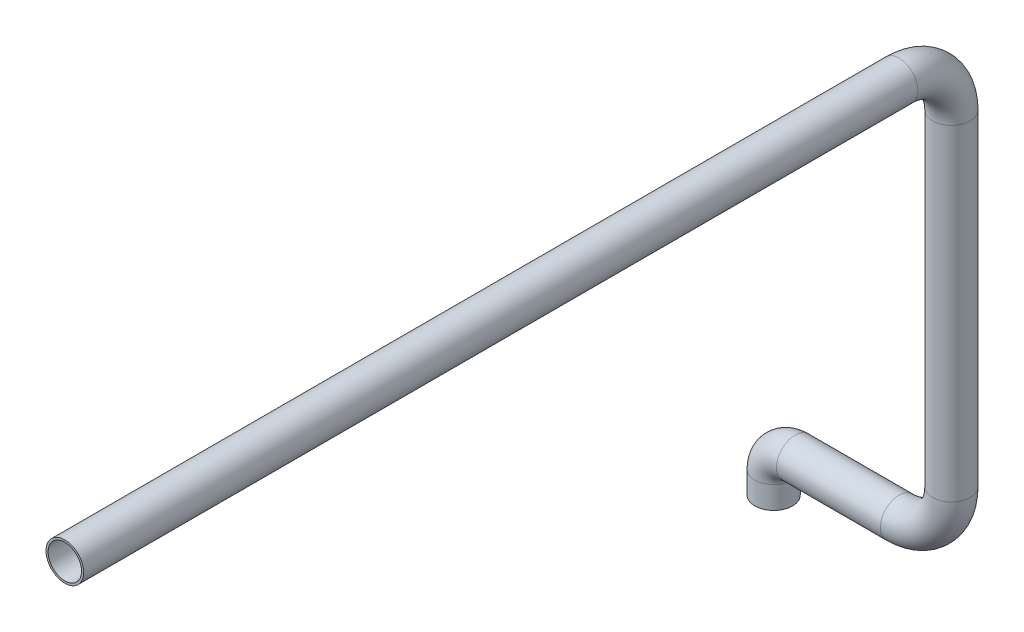
from build123d import *

# Parameters (mm, degrees)
SWEEP1_PROFILE_R                           = 9
HOLLOW_TUBE_OD_AND_WALL_PROVISIONAL_PROF_R = 8


with BuildPart() as part:
    # Sweep1: sweep along a curve in space
    with BuildLine() as sweep1_path:
        Line((0, 0, 0), (0, 10.710000757, 0))
        ThreePointArc((0, 10.710000757, 0), (3.013871267, 17.986129267, 0), (10.29, 21, 0))
        Line((10.29, 21, 0), (60.000001606, 21, 0))
        ThreePointArc((60.000001606, 21, 0), (77.677670568, 28.322330568, 0), (85, 46, 0))
        Line((85, 46, 0), (85, 202.000001606, 0))
        ThreePointArc((85, 202.000001606, 0), (85, 219.677670568, 7.322330568), (85, 227, 25))
        Line((85, 227, 25), (85, 227, 424))
    # Sweep1 profile (on start of the path) → Sweep1 (sweep)
    with BuildSketch(Plane.ZX):
        Circle(SWEEP1_PROFILE_R)
    sweep(path=sweep1_path.line)

    # Hollow_tube_OD_and_wall_PROVISIONAL: sweep along a curve in space
    with BuildLine() as hollow_tube_od_and_wall_provisional_path:
        Line((0, 0, 0), (0, 10.710000757, 0))
        ThreePointArc((0, 10.710000757, 0), (3.013871267, 17.986129267, 0), (10.29, 21, 0))
        Line((10.29, 21, 0), (60.000001606, 21, 0))
        ThreePointArc((60.000001606, 21, 0), (77.677670568, 28.322330568, 0), (85, 46, 0))
        Line((85, 46, 0), (85, 202.000001606, 0))
        ThreePointArc((85, 202.000001606, 0), (85, 219.677670568, 7.322330568), (85, 227, 25))
        Line((85, 227, 25), (85, 227, 424))
    # Hollow_tube_OD_and_wall_PROVISIONAL prof (on start of the path) → Hollow_tube_OD_and_wall_PROVISIONAL (sweep, cut)
    with BuildSketch(Plane.ZX):
        Circle(HOLLOW_TUBE_OD_AND_WALL_PROVISIONAL_PROF_R)
    sweep(path=hollow_tube_od_and_wall_provisional_path.line, mode=Mode.SUBTRACT)


solid = part.part
